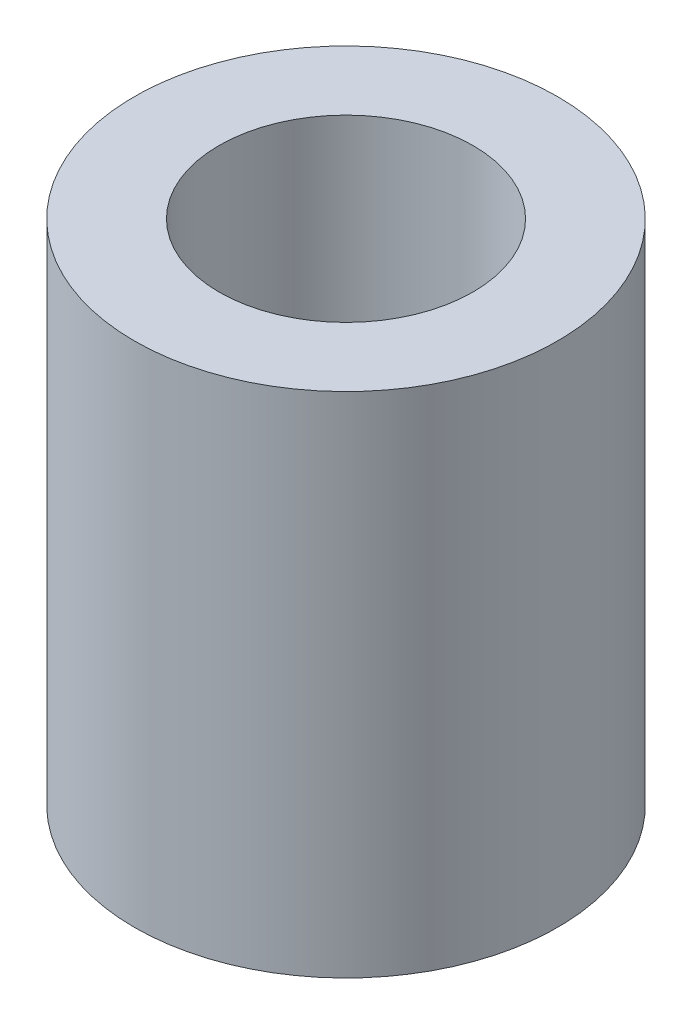
from build123d import *

# Parameters (mm, degrees)
SKETCH_4_R      = 5
SKETCH_4_R_2    = 3
EXTRUDE_3_DEPTH = 10
EXTRUDE_START   = 2
SKETCH_5_R      = 5
EXTRUDE_5_DEPTH = 2


with BuildPart() as part:
    # 草图4 → 凸台-拉伸3 (new body)
    with BuildSketch(Plane(origin=(0, 0, 0), x_dir=(1, 0, 0), z_dir=(0, 1, 0))):
        with Locations(Location((0, 0, 0), (0, 0, 270))):
            Circle(SKETCH_4_R)
        with Locations(Location((0, 0, 0), (0, 0, 270))):
            Circle(SKETCH_4_R_2, mode=Mode.SUBTRACT)
    extrude(amount=EXTRUDE_3_DEPTH)

    # 草图5 → 凸台-拉伸5 (add)
    with BuildSketch(Plane.XZ.offset(EXTRUDE_START)):
        with Locations(Location((0, 0, 0), (0, 0, 270))):
            Circle(SKETCH_5_R)
    extrude(amount=-EXTRUDE_5_DEPTH)


solid = part.part
